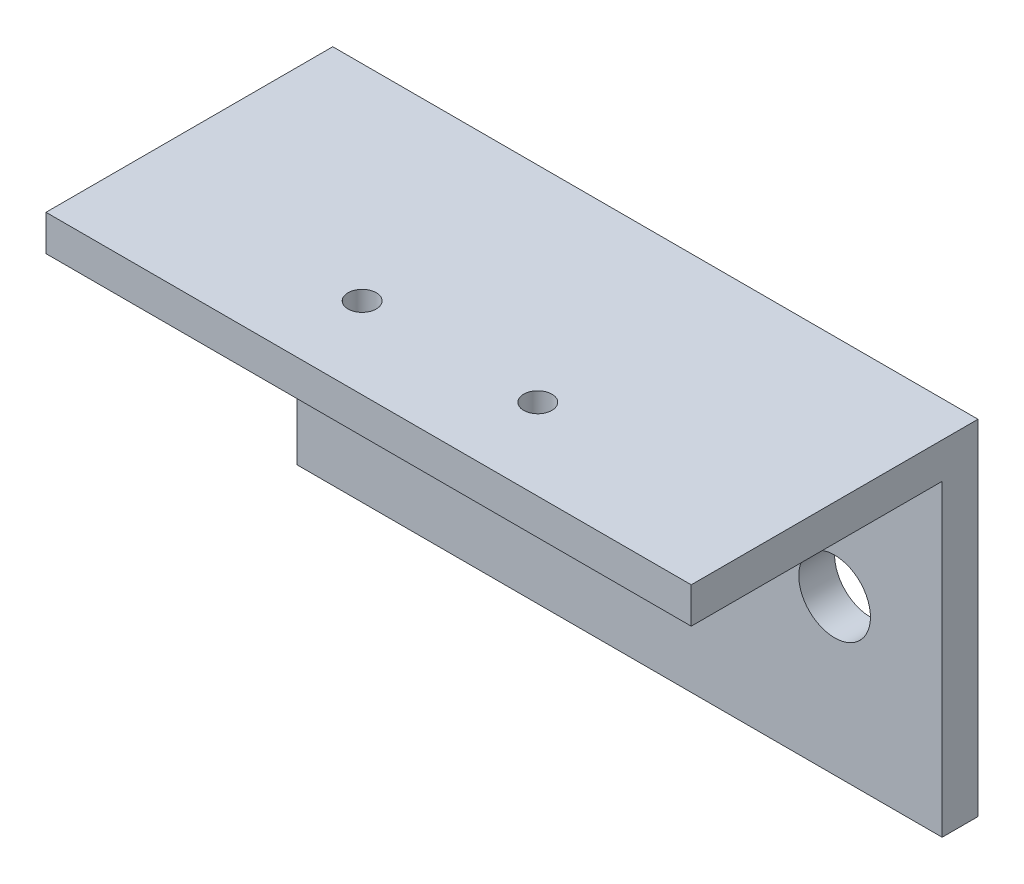
from build123d import *

# Parameters (mm, degrees)
SKETCH3_W           = 57.15
SKETCH3_H           = 30.48
BOSS_EXTRUDE2_DEPTH = 3.175
SKETCH4_W           = 57.15
SKETCH4_H           = 3.175
BOSS_EXTRUDE3_DEPTH = 22.225
SKETCH6_R           = 1.25
CUT_EXTRUDE1_DEPTH  = 3.175
SKETCH7_R           = 3.175
CUT_EXTRUDE2_DEPTH  = 3.175


with BuildPart() as part:
    # Sketch3 → Boss-Extrude2 (new body)
    with BuildSketch(Plane.XY):
        with Locations((28.575, 15.24)):
            Rectangle(SKETCH3_W, SKETCH3_H)
    extrude(amount=BOSS_EXTRUDE2_DEPTH)

    # Sketch4 → Boss-Extrude3 (add)
    with BuildSketch(Plane.XY.offset(3.175)):
        with Locations((28.575, 28.8925)):
            Rectangle(SKETCH4_W, SKETCH4_H)
    extrude(amount=BOSS_EXTRUDE3_DEPTH)

    # Sketch6 → Cut-Extrude1 (cut)
    with BuildSketch(Plane(origin=(0, 30.48, 0), x_dir=(1, 0, 0), z_dir=(0, 1, 0))):
        with Locations(Location((36.353174593, -18.1939997, 0), (0, 0, 270))):
            Circle(SKETCH6_R)
        with Locations(Location((20.796825407, -18.1939997, 0), (0, 0, 270))):
            Circle(SKETCH6_R)
    extrude(amount=-CUT_EXTRUDE1_DEPTH, mode=Mode.SUBTRACT)

    # Sketch7 → Cut-Extrude2 (cut)
    with BuildSketch(Plane.XY.offset(3.175)):
        with Locations((47.625, 13.713)):
            Circle(SKETCH7_R)
        with Locations((9.525, 13.713)):
            Circle(SKETCH7_R)
    extrude(amount=-CUT_EXTRUDE2_DEPTH, mode=Mode.SUBTRACT)


solid = part.part
